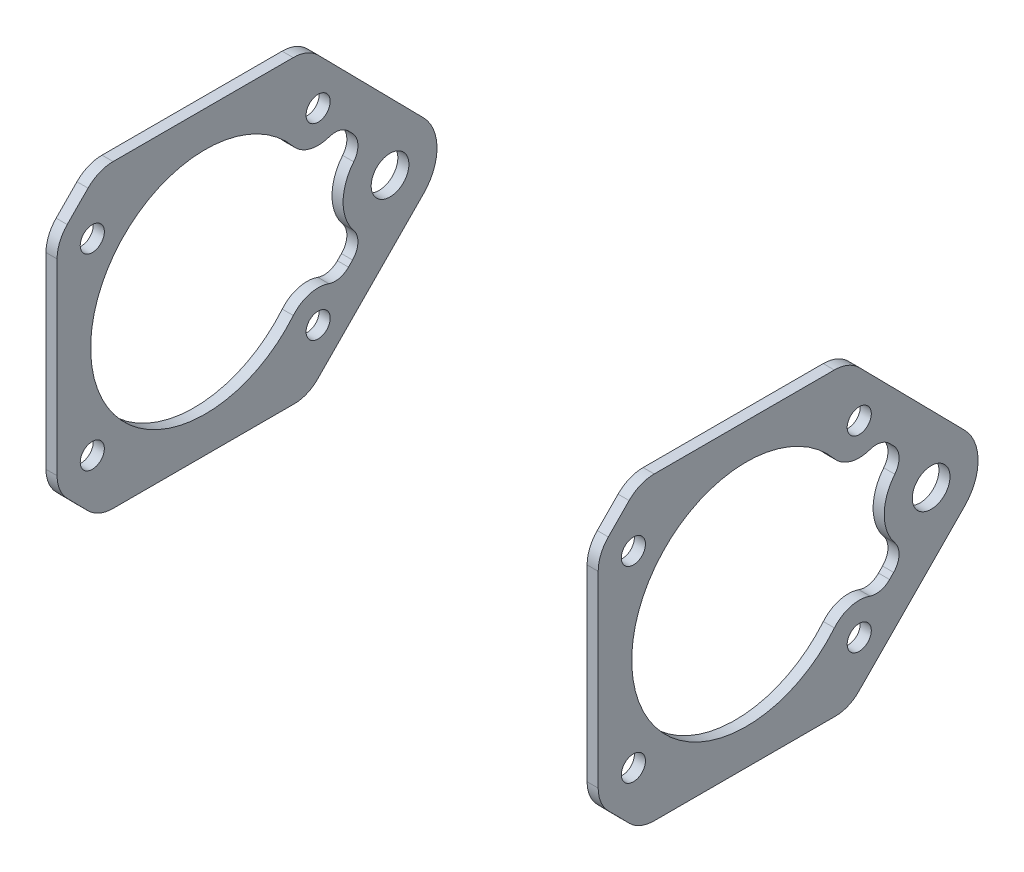
from build123d import *

# Parameters (mm, degrees)
SKETCH1_R              = 1.63195
BOSS_EXTRUDE1_DEPTH    = 1.500000048
F_10_CLEARANCE_HOLE1_D = 5.1054


with BuildPart() as part:
    # Sketch1 → Boss-Extrude1 (new body)
    with BuildSketch(Plane.ZY.offset(-37.349999952)):
        with BuildLine():
            Line((-4.523311473, 4.45669758), (9.707310197, 18.900023185))
            ThreePointArc((9.707310197, 18.900023185), (11.26095727, 19.950686367), (13.099793802, 20.32))
            Line((13.099793802, 20.32), (37.463604709, 20.32))
            ThreePointArc((37.463604709, 20.32), (39.30244124, 19.950686367), (40.856088313, 18.900023185))
            Line((40.856088313, 18.900023185), (43.671506489, 16.042523185))
            ThreePointArc((43.671506489, 16.042523185), (44.685728537, 14.50619809), (45.041522884, 12.7))
            Line((45.041522884, 12.7), (45.041522884, -12.7))
            ThreePointArc((45.041522884, -12.7), (44.685728537, -14.50619809), (43.671506489, -16.042523185))
            Line((43.671506489, -16.042523185), (40.856088313, -18.900023185))
            ThreePointArc((40.856088313, -18.900023185), (39.30244124, -19.950686367), (37.463604709, -20.32))
            Line((37.463604709, -20.32), (12.933675594, -20.32))
            ThreePointArc((12.933675594, -20.32), (11.248075439, -19.981462503), (9.823898956, -19.018354586))
            Line((9.823898956, -19.018354586), (-4.523311473, -4.45669758))
            ThreePointArc((-4.523311473, -4.45669758), (-6.35, 0), (-4.523311473, 4.45669758))
        make_face()
        with Locations((9.727227116, 12.7)):
            Circle(SKETCH1_R, mode=Mode.SUBTRACT)
        with Locations((40.279022884, 12.7)):
            Circle(SKETCH1_R, mode=Mode.SUBTRACT)
        with Locations((40.279022884, -12.7)):
            Circle(SKETCH1_R, mode=Mode.SUBTRACT)
        with Locations((9.727227116, -12.7)):
            Circle(SKETCH1_R, mode=Mode.SUBTRACT)
        with BuildLine():
            Line((5.623425104, -7.969382632), (5.072632622, -7.4103575))
            ThreePointArc((5.072632622, -7.4103575), (4.344674108, -5.74512827), (4.915683722, -4.019770335))
            ThreePointArc((4.915683722, -4.019770335), (6.35, 0), (4.915683722, 4.019770335))
            ThreePointArc((4.915683722, 4.019770335), (4.344674108, 5.74512827), (5.072632622, 7.4103575))
            Line((5.072632622, 7.4103575), (5.623425104, 7.969382632))
            ThreePointArc((5.623425104, 7.969382632), (6.86096625, 8.661509389), (8.276695412, 8.582398828))
            ThreePointArc((8.276695412, 8.582398828), (10.888550016, 8.491673639), (13.084224026, 9.909076607))
            ThreePointArc((13.084224026, 9.909076607), (40.503124988, 0), (13.084224026, -9.909076607))
            ThreePointArc((13.084224026, -9.909076607), (10.888550016, -8.491673639), (8.276695412, -8.582398828))
            ThreePointArc((8.276695412, -8.582398828), (6.86096625, -8.661509389), (5.623425104, -7.969382632))
        make_face(mode=Mode.SUBTRACT)
    extrude(amount=BOSS_EXTRUDE1_DEPTH)

    # #10 Clearance Hole1 (through all)
    with Locations(Plane.ZY.offset(-35.849999904)):
        with Locations((0, 0)):
            Hole(F_10_CLEARANCE_HOLE1_D / 2)


with BuildPart() as body_2:
    # Mirror2: mirrored copy
    add(part.part.mirror(Plane(origin=(0, 0, 0), x_dir=(0, 0, 1), z_dir=(1, 0, 0))))


solid = Compound([part.part, body_2.part])
